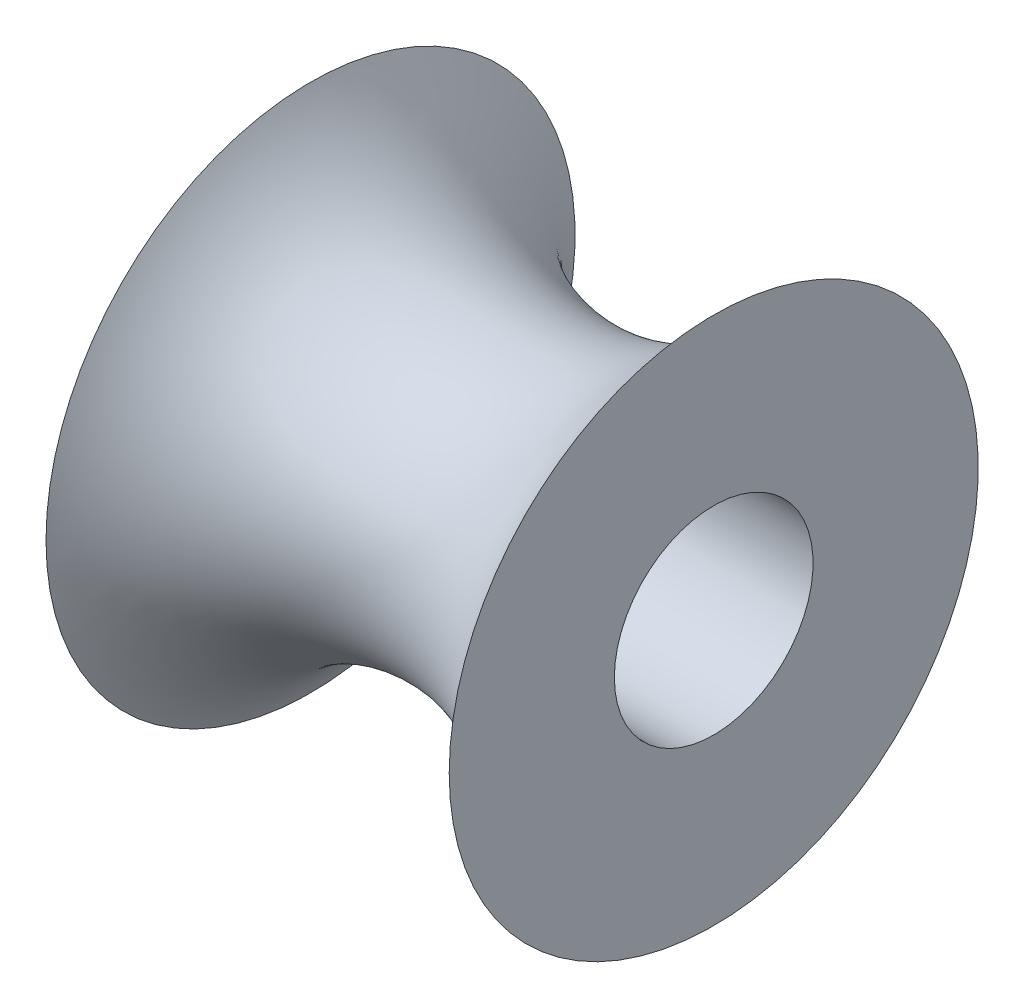
from build123d import *


with BuildPart() as part:
    # Sketch1 → Revolve2 (revolve)
    with BuildSketch(Plane(origin=(0, 0, 0), x_dir=(1, 0, 0), z_dir=(0, 1, 0))):
        with BuildLine():
            Line((-4.639913961, 6.123399444), (-4.639913961, 2.3))
            Line((-4.639913961, 2.3), (4.693419373, 2.3))
            Line((4.693419373, 2.3), (4.693419373, 6.123399444))
            ThreePointArc((4.693419373, 6.123399444), (0.026752706, 3.374731981), (-4.639913961, 6.123399444))
        make_face()
    revolve(axis=Axis((-4.639913961, 0, 0), (1, 0, 0)))


solid = part.part
